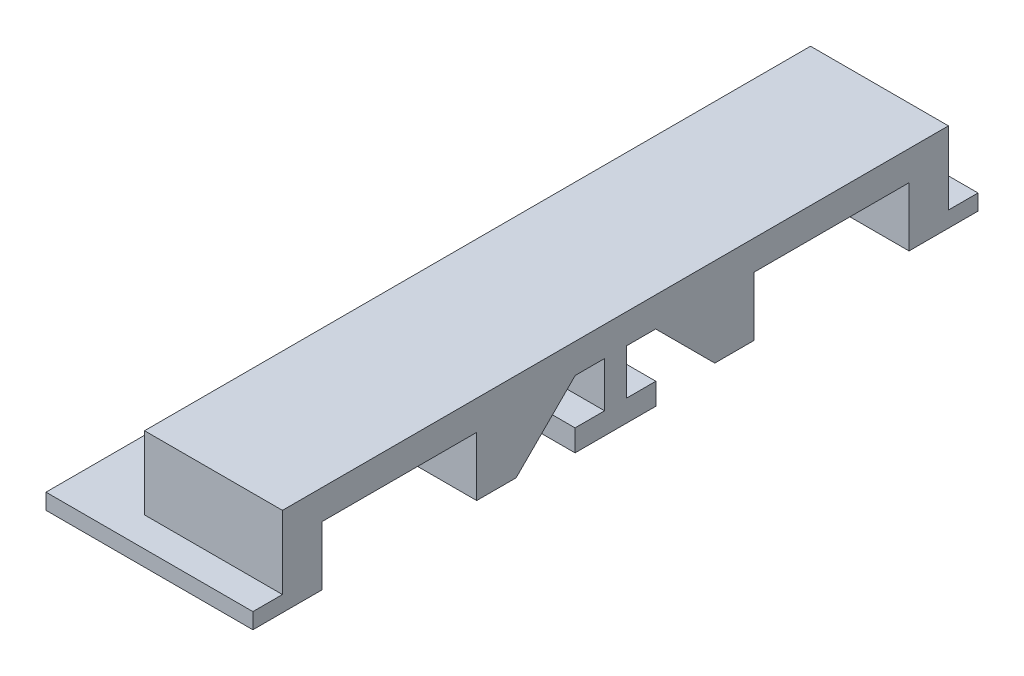
from build123d import *

# Parameters (mm, degrees)
BOSS_EXTRUDE1_DEPTH = 7
SKETCH1_3_W         = 7.858578644
SKETCH1_3_H         = 0.8
BOSS_EXTRUDE2_DEPTH = 3.5


with BuildPart() as part:
    # Sketch1 → Boss-Extrude1 (new body)
    with BuildSketch(Plane(origin=(0, 0, 0), x_dir=(0, 0, -1), z_dir=(1, 0, 0))):
        Polygon((-14.9, 4.6), (-7.041421356, 4.6), (-7.041421356, 1.6), (-5.041421356, 1.6), (-2.041421356, 4.6), (-0.55, 4.6), (-0.55, 2.3), (-2.05, 2.3), (-2.05, 1.2), (2.05, 1.2), (2.05, 2.3), (0.55, 2.3), (0.55, 4.6), (2.041421356, 4.6), (5.041421356, 1.6), (7.041421356, 1.6), (7.041421356, 4.6), (14.9, 4.6), (14.9, 1.6), (18.4, 1.6), (18.4, 2.4), (16.9, 2.4), (16.9, 6.1), (-16.9, 6.1), (-16.9, 2.4), (-18.4, 2.4), (-18.4, 1.6), (-14.9, 1.6), align=None)
    extrude(amount=BOSS_EXTRUDE1_DEPTH)

    # Sketch1<3> → Boss-Extrude2 (add, symmetric)
    with BuildSketch(Plane(origin=(0, 0, 0), x_dir=(0, 0, -1), z_dir=(1, 0, 0))):
        Polygon((7.041421356, 2.4), (4.241421356, 2.4), (5.041421356, 1.6), (7.041421356, 1.6), align=None)
        Polygon((17, 2.4), (16.9, 2.4), (14.9, 2.4), (14.9, 1.6), (17, 1.6), (18.4, 1.6), (18.4, 2.4), align=None)
        with Locations((10.970710678, 2)):
            Rectangle(SKETCH1_3_W, SKETCH1_3_H)
        with Locations((-10.970710678, 2)):
            Rectangle(SKETCH1_3_W, SKETCH1_3_H)
        Polygon((-4.241421356, 2.4), (-7.041421356, 2.4), (-7.041421356, 1.6), (-5.041421356, 1.6), align=None)
        Polygon((-14.9, 1.6), (-14.9, 2.4), (-16.9, 2.4), (-17, 2.4), (-18.4, 2.4), (-18.4, 1.6), (-17, 1.6), align=None)
    extrude(amount=BOSS_EXTRUDE2_DEPTH, both=True)


solid = part.part
